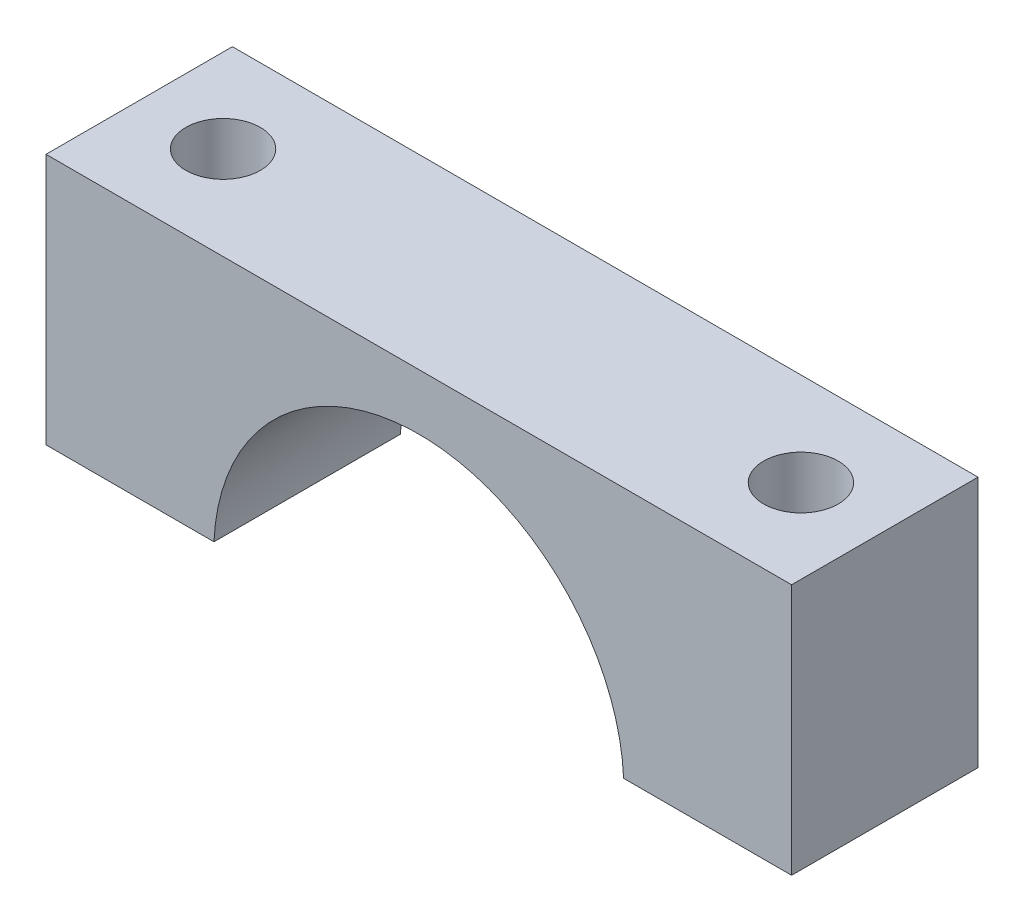
from build123d import *

# Parameters (mm, degrees)
ESQUISSE2_W             = 40
ESQUISSE2_H             = 10
BOSS_EXTRU_2_DEPTH      = 13.5
ENL_V_MAT_EXTRU_3_DEPTH = 30.780378473
ESQUISSE5_R             = 2
ENL_V_MAT_EXTRU_4_DEPTH = 32.649869703


with BuildPart() as part:
    # Esquisse2 → Boss.-Extru.2 (new body)
    with BuildSketch(Plane(origin=(0, 0, 0), x_dir=(1, 0, 0), z_dir=(0, 1, 0))):
        with Locations((4.589041096, 9.657534247)):
            Rectangle(ESQUISSE2_W, ESQUISSE2_H)
    extrude(amount=BOSS_EXTRU_2_DEPTH)

    # Esquisse4 → Enlèv. mat.-Extru.3 (cut, through all)
    with BuildSketch(Plane.XY.offset(-4.657534247)):
        with BuildLine():
            Line((-6.399589392, 0), (15.577671584, 0))
            ThreePointArc((15.577671584, 0), (4.589041096, 10.5), (-6.399589392, 0))
        make_face()
    extrude(amount=-ENL_V_MAT_EXTRU_3_DEPTH, mode=Mode.SUBTRACT)

    # Esquisse5 → Enlèv. mat.-Extru.4 (cut, through all)
    with BuildSketch(Plane(origin=(0, 13.5, 0), x_dir=(1, 0, 0), z_dir=(0, 1, 0))):
        with Locations(Location((-10.910958904, 9.657534247, 0), (0, 0, 270))):
            Circle(ESQUISSE5_R)
        with Locations(Location((20.089041096, 9.657534247, 0), (0, 0, 90))):
            Circle(ESQUISSE5_R)
    extrude(amount=-ENL_V_MAT_EXTRU_4_DEPTH, mode=Mode.SUBTRACT)


solid = part.part
